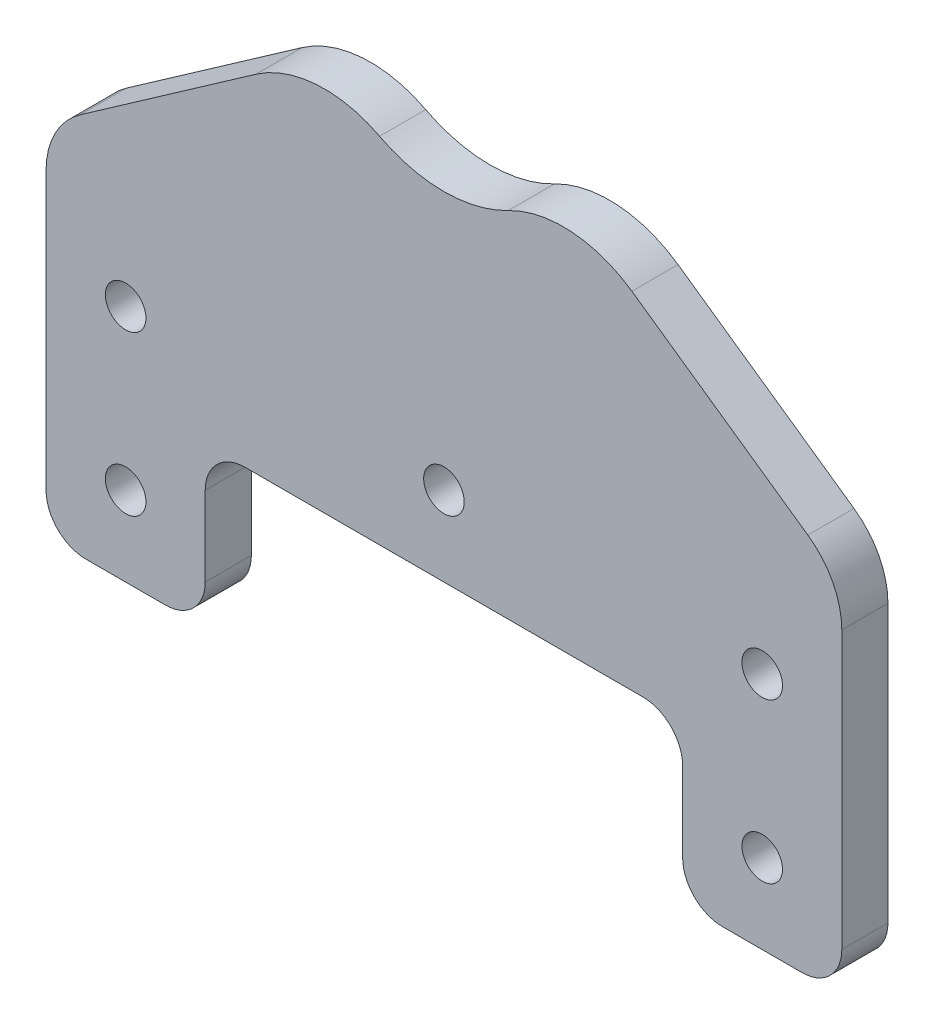
from build123d import *

# Parameters (mm, degrees)
SKETCH_1_R          = 7.5
SKETCH_1_R_2        = 2.55
EXTRUDE_1_DEPTH     = 5.8
SKETCH_2_W          = 20
SKETCH_2_H          = 20
SKETCH_2_R          = 2.55
EXTRUDE_2_DEPTH     = 5.8
FILLET_1_R          = 5
SKETCH_3_OUTSIDE_W  = 130.308
SKETCH_3_OUTSIDE_H  = 130.308
CUT_EXTRUDE_1_DEPTH = 95.517934806


with BuildPart() as part:
    # ｽｹｯﾁ1 → ﾎﾞｽ - 押し出し1 (new body)
    with BuildSketch(Plane.XY):
        with BuildLine():
            Line((-50, -60), (50, -60))
            Line((50, -60), (50, -30))
            ThreePointArc((50, -30), (0, 20), (-50, -30))
            Line((-50, -30), (-50, -60))
        make_face()
        Circle(SKETCH_1_R, mode=Mode.SUBTRACT)
        with Locations((-40, -50)):
            Circle(SKETCH_1_R_2, mode=Mode.SUBTRACT)
        with Locations((0, -50)):
            Circle(SKETCH_1_R_2, mode=Mode.SUBTRACT)
        with Locations((40, -50)):
            Circle(SKETCH_1_R_2, mode=Mode.SUBTRACT)
    extrude(amount=EXTRUDE_1_DEPTH)

    # ｽｹｯﾁ2 → ﾎﾞｽ - 押し出し2 (add)
    # profile 1 of 2: a face of its own
    with BuildSketch(Plane.XY.offset(5.8)):
        with Locations((-40, -70)):
            Rectangle(SKETCH_2_W, SKETCH_2_H)
        with Locations((-40, -70)):
            Circle(SKETCH_2_R, mode=Mode.SUBTRACT)
    # profile 2 of 2: a face of its own
    with BuildSketch(Plane.XY.offset(5.8)):
        with Locations((40, -70)):
            Rectangle(SKETCH_2_W, SKETCH_2_H)
        with Locations(Location((40, -70, 0), (0, 0, 180))):
            Circle(SKETCH_2_R, mode=Mode.SUBTRACT)
    extrude(amount=-EXTRUDE_2_DEPTH)

    # ﾌｨﾚｯﾄ1
    fillet_1_edges = [part.edges().sort_by_distance(p)[0] for p in [
        (-50, -80, 2.9),
        (-30, -60, 2.9),
        (-30, -80, 2.9),
        (30, -60, 2.9),
        (50, -80, 2.9),
        (30, -80, 2.9),
    ]]
    fillet(fillet_1_edges, radius=FILLET_1_R)

    # ｽｹｯﾁ3 outside → ｶｯﾄ - 押し出し1 (cut, through all)
    with BuildSketch(Plane(origin=(0, 0, 0), x_dir=(-1, 0, 0), z_dir=(0, 0, -1))):
        with Locations((0, -30)):
            Rectangle(SKETCH_3_OUTSIDE_W, SKETCH_3_OUTSIDE_H)
        with BuildLine():
            Line((-45.734623444, -32.014236411), (-23.619608507, -16.533725955))
            ThreePointArc((-23.619608507, -16.533725955), (-15.994862618, -13.854068569), (-8.086439492, -15.519648718))
            ThreePointArc((-8.086439492, -15.519648718), (0, -17.5), (8.086439492, -15.519648718))
            ThreePointArc((8.086439492, -15.519648718), (15.994862618, -13.854068569), (23.619608507, -16.533725955))
            Line((23.619608507, -16.533725955), (45.734623444, -32.014236411))
            ThreePointArc((45.734623444, -32.014236411), (48.869786763, -35.588451808), (50, -40.206555616))
            Line((50, -40.206555616), (50, -75))
            ThreePointArc((50, -75), (48.535533906, -78.535533906), (45, -80))
            Line((45, -80), (35, -80))
            ThreePointArc((35, -80), (31.464466094, -78.535533906), (30, -75))
            Line((30, -75), (30, -65))
            ThreePointArc((30, -65), (28.535533906, -61.464466094), (25, -60))
            Line((25, -60), (-25, -60))
            ThreePointArc((-25, -60), (-28.535533906, -61.464466094), (-30, -65))
            Line((-30, -65), (-30, -75))
            ThreePointArc((-30, -75), (-31.464466094, -78.535533906), (-35, -80))
            Line((-35, -80), (-45, -80))
            ThreePointArc((-45, -80), (-48.535533906, -78.535533906), (-50, -75))
            Line((-50, -75), (-50, -40.206555616))
            ThreePointArc((-50, -40.206555616), (-48.869786763, -35.588451808), (-45.734623444, -32.014236411))
        make_face(mode=Mode.SUBTRACT)
    extrude(amount=-CUT_EXTRUDE_1_DEPTH, mode=Mode.SUBTRACT)


solid = part.part
